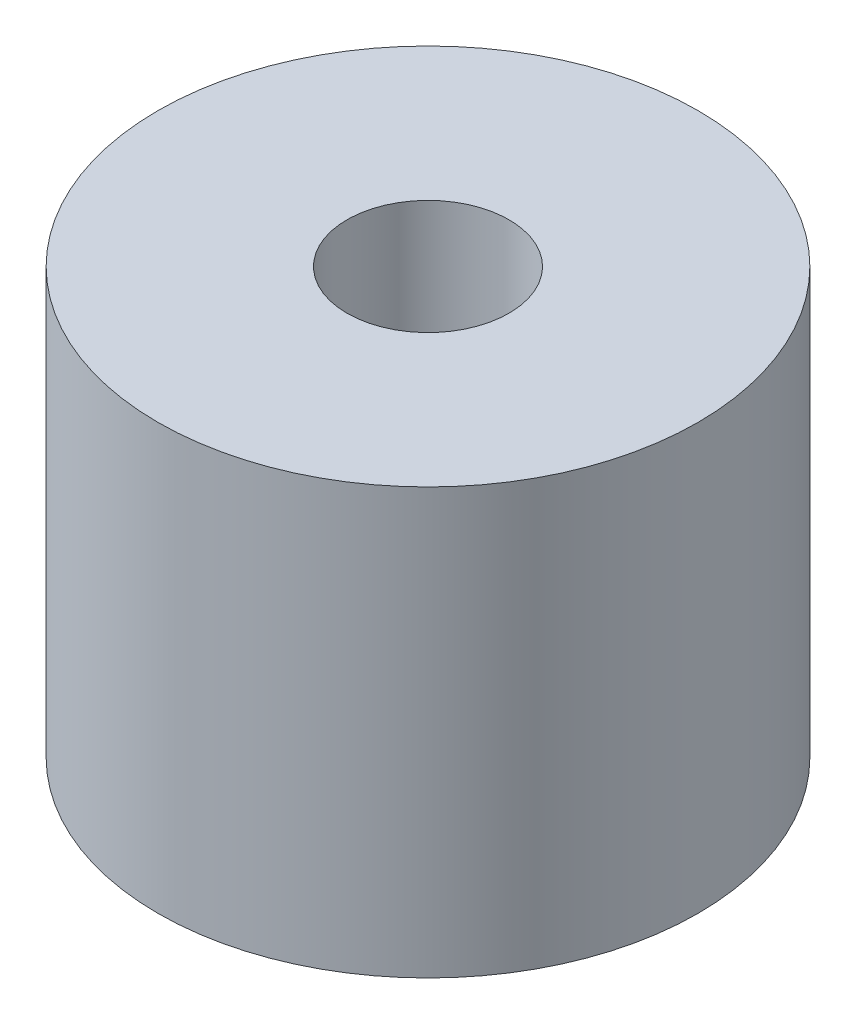
from build123d import *

# Parameters (mm, degrees)
SKETCH1_R           = 12.7
SKETCH1_R_2         = 3.81
BOSS_EXTRUDE1_DEPTH = 20


with BuildPart() as part:
    # Sketch1 → Boss-Extrude1 (new body)
    with BuildSketch(Plane(origin=(0, 0, 0), x_dir=(1, 0, 0), z_dir=(0, 1, 0))):
        with Locations(Location((0, 0, 0), (0, 0, 270))):
            Circle(SKETCH1_R)
        with Locations(Location((0, 0, 0), (0, 0, 270))):
            Circle(SKETCH1_R_2, mode=Mode.SUBTRACT)
    extrude(amount=BOSS_EXTRUDE1_DEPTH)


solid = part.part
